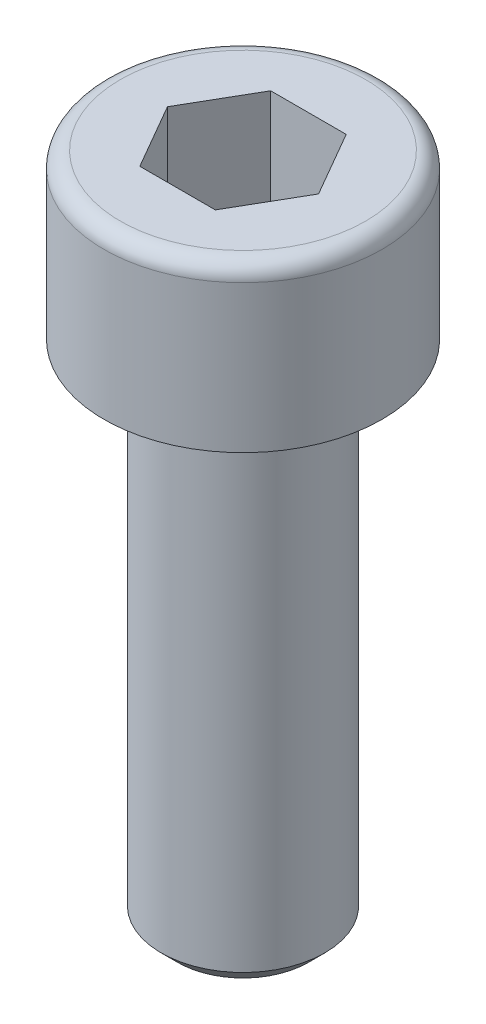
from build123d import *

# Parameters (mm, degrees)
CHAMFER_1_SIZE      = 0.5
CUT_EXTRUDE_1_DEPTH = 3


with BuildPart() as part:
    # Эскиз1 → Повернуть1 (revolve)
    with BuildSketch(Plane.XY):
        with BuildLine():
            Line((0, 0), (2.5, 0))
            Line((2.5, 0), (2.5, 15))
            ThreePointArc((2.5, 15), (2.646446609, 15.353553391), (3, 15.5))
            Line((3, 15.5), (4.25, 15.5))
            Line((4.25, 15.5), (4.25, 20))
            ThreePointArc((4.25, 20), (4.103553391, 20.353553391), (3.75, 20.5))
            Line((3.75, 20.5), (0, 20.5))
            Line((0, 20.5), (0, 0))
        make_face()
    revolve(axis=Axis((0, -169.015508263, 0), (0, 1, 0)))

    # Фаска1
    chamfer_1_edges = [part.edges().sort_by_distance(p)[0] for p in [
        (-2.5, 0, 0),
    ]]
    chamfer(chamfer_1_edges, length=CHAMFER_1_SIZE)

    # Эскиз2 → Вырез-Вытянуть1 (cut)
    with BuildSketch(Plane(origin=(0, 20.5, 0), x_dir=(1, 0, 0), z_dir=(0, 1, 0))):
        Polygon((2.309401077, 0), (1.154700538, 2), (-1.154700538, 2), (-2.309401077, 0), (-1.154700538, -2), (1.154700538, -2), align=None)
    extrude(amount=-CUT_EXTRUDE_1_DEPTH, mode=Mode.SUBTRACT)


solid = part.part
